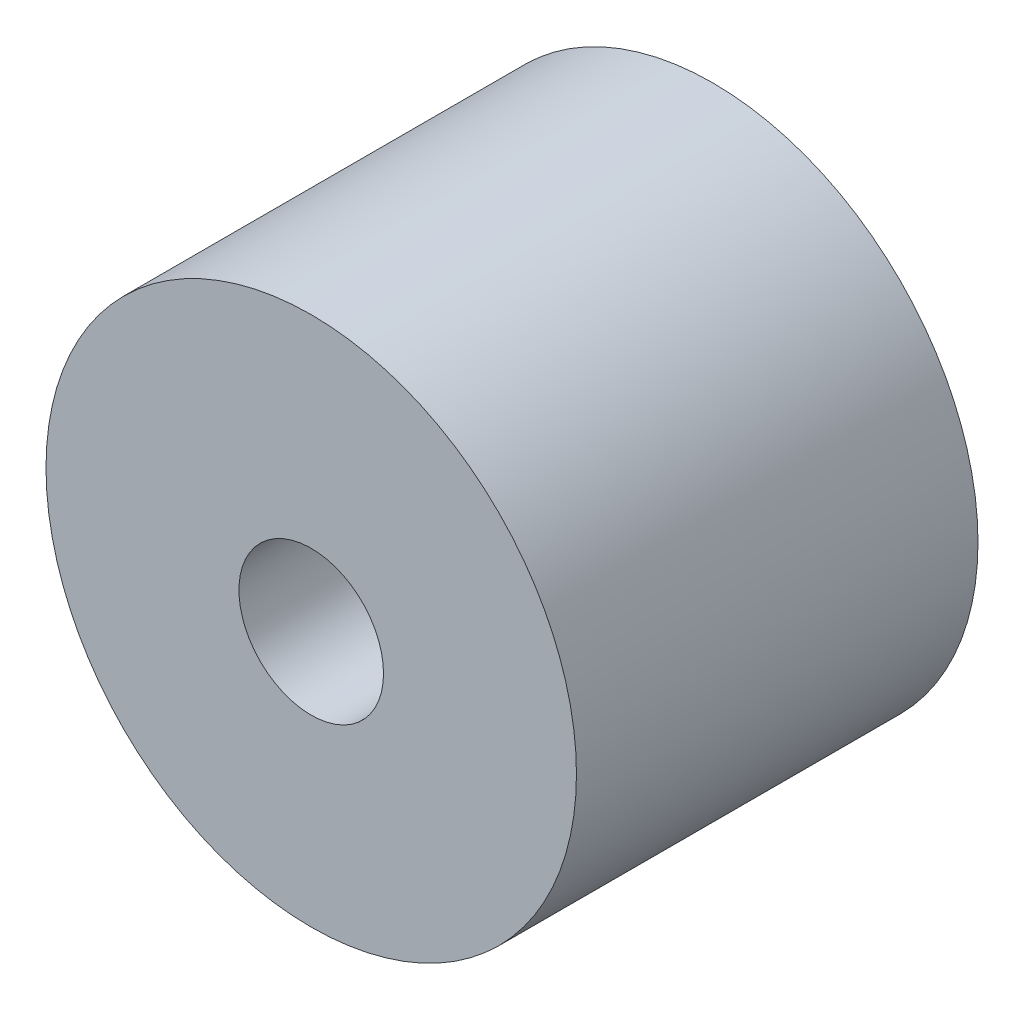
from build123d import *

# Parameters (mm, degrees)
SKETCH1_R           = 34.349108364
BOSS_EXTRUDE1_DEPTH = 52
SKETCH2_R           = 9.360896348
CUT_EXTRUDE1_DEPTH  = 52


with BuildPart() as part:
    # Sketch1 → Boss-Extrude1 (new body)
    with BuildSketch(Plane.XY):
        with Locations((0, -2.37274116)):
            Circle(SKETCH1_R)
    extrude(amount=BOSS_EXTRUDE1_DEPTH)

    # Sketch2 → Cut-Extrude1 (cut)
    with BuildSketch(Plane.XY.offset(52)):
        with Locations((0, -3.588547433)):
            Circle(SKETCH2_R)
    extrude(amount=-CUT_EXTRUDE1_DEPTH, mode=Mode.SUBTRACT)


solid = part.part
